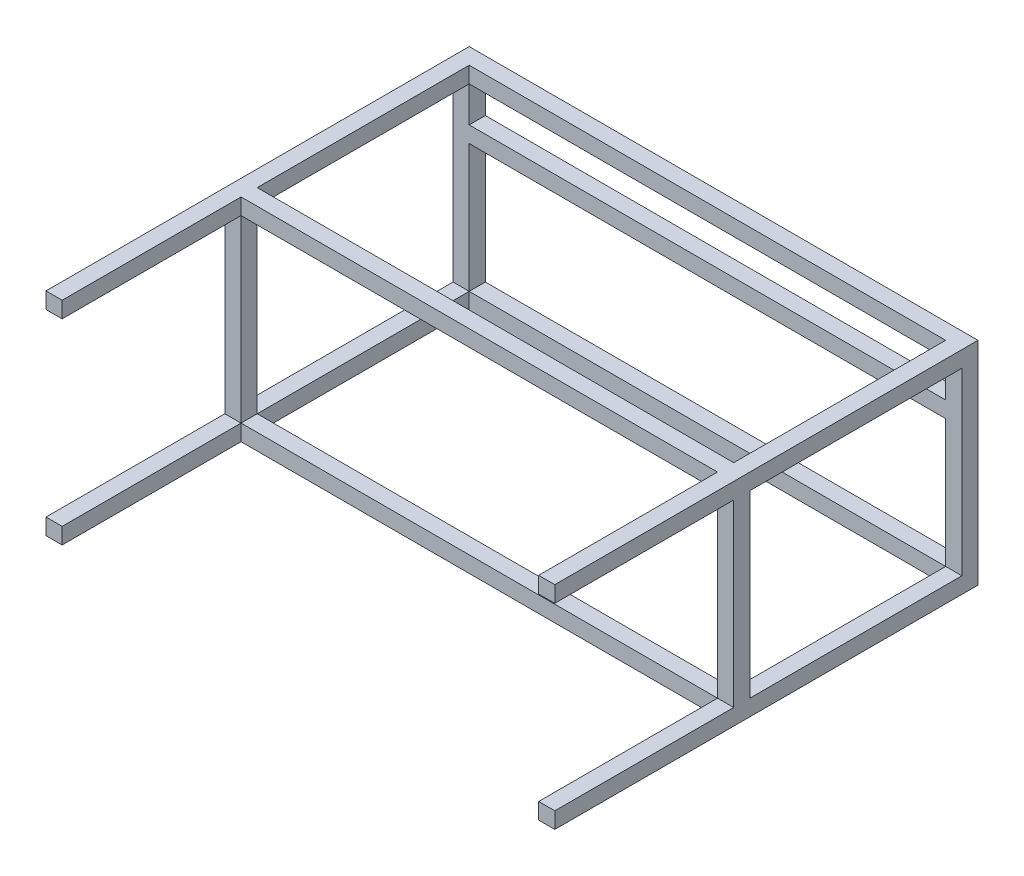
from build123d import *

# Parameters (mm, degrees)
CROQUIS1_W              = 1200
CROQUIS1_H              = 500
CROQUIS1_W_2            = 1123.8
CROQUIS1_H_2            = 423.8
SALIENTE_EXTRUIR1_DEPTH = 38.1
CROQUIS2_W              = 38.1
CROQUIS2_H              = 38.1
SALIENTE_EXTRUIR2_DEPTH = 960
CROQUIS3_W              = 1123.8
CROQUIS3_H              = 38.1
SALIENTE_EXTRUIR4_DEPTH = 38.1
CROQUIS4_W              = 1123.8
CROQUIS4_H              = 38.1
SALIENTE_EXTRUIR5_DEPTH = 38.1
CROQUIS5_W              = 1123.8
CROQUIS5_H              = 38.1
SALIENTE_EXTRUIR6_DEPTH = 38.1
CROQUIS6_W              = 38.1
CROQUIS6_H              = 423.8
SALIENTE_EXTRUIR7_DEPTH = 38.1
CROQUIS7_W              = 38.1
CROQUIS7_H              = 423.8
SALIENTE_EXTRUIR8_DEPTH = 38.1


with BuildPart() as part:
    # Croquis1 → Saliente-Extruir1 (new body)
    with BuildSketch(Plane.XY):
        Rectangle(CROQUIS1_W, CROQUIS1_H)
        Rectangle(CROQUIS1_W_2, CROQUIS1_H_2, mode=Mode.SUBTRACT)
    extrude(amount=SALIENTE_EXTRUIR1_DEPTH)

    # Croquis2 → Saliente-Extruir2 (add)
    with BuildSketch(Plane.XY.offset(38.1)):
        with Locations((-580.95, 230.95)):
            Rectangle(CROQUIS2_W, CROQUIS2_H)
        with Locations((-580.95, -230.95)):
            Rectangle(CROQUIS2_W, CROQUIS2_H)
        with Locations((580.95, 230.95)):
            Rectangle(CROQUIS2_W, CROQUIS2_H)
        with Locations((580.95, -230.95)):
            Rectangle(CROQUIS2_W, CROQUIS2_H)
    extrude(amount=SALIENTE_EXTRUIR2_DEPTH)

    # Croquis3 → Saliente-Extruir4 (add)
    with BuildSketch(Plane(origin=(0, 0, 0), x_dir=(-1, 0, 0), z_dir=(0, 0, -1))):
        with Locations((0, 109.05)):
            Rectangle(CROQUIS3_W, CROQUIS3_H)
    extrude(amount=-SALIENTE_EXTRUIR4_DEPTH)

    # Croquis4 → Saliente-Extruir5 (add)
    with BuildSketch(Plane.XZ.offset(250)):
        with Locations((0, 557.15)):
            Rectangle(CROQUIS4_W, CROQUIS4_H)
    extrude(amount=-SALIENTE_EXTRUIR5_DEPTH)

    # Croquis5 → Saliente-Extruir6 (add)
    with BuildSketch(Plane(origin=(0, 250, 0), x_dir=(1, 0, 0), z_dir=(0, 1, 0))):
        with Locations((0, -557.15)):
            Rectangle(CROQUIS5_W, CROQUIS5_H)
    extrude(amount=-SALIENTE_EXTRUIR6_DEPTH)

    # Croquis6 → Saliente-Extruir7 (add)
    with BuildSketch(Plane.ZY.offset(600)):
        with Locations((557.15, 0)):
            Rectangle(CROQUIS6_W, CROQUIS6_H)
    extrude(amount=-SALIENTE_EXTRUIR7_DEPTH)

    # Croquis7 → Saliente-Extruir8 (add)
    with BuildSketch(Plane(origin=(600, 0, 0), x_dir=(0, 0, -1), z_dir=(1, 0, 0))):
        with Locations((-557.15, 0)):
            Rectangle(CROQUIS7_W, CROQUIS7_H)
    extrude(amount=-SALIENTE_EXTRUIR8_DEPTH)


solid = part.part
